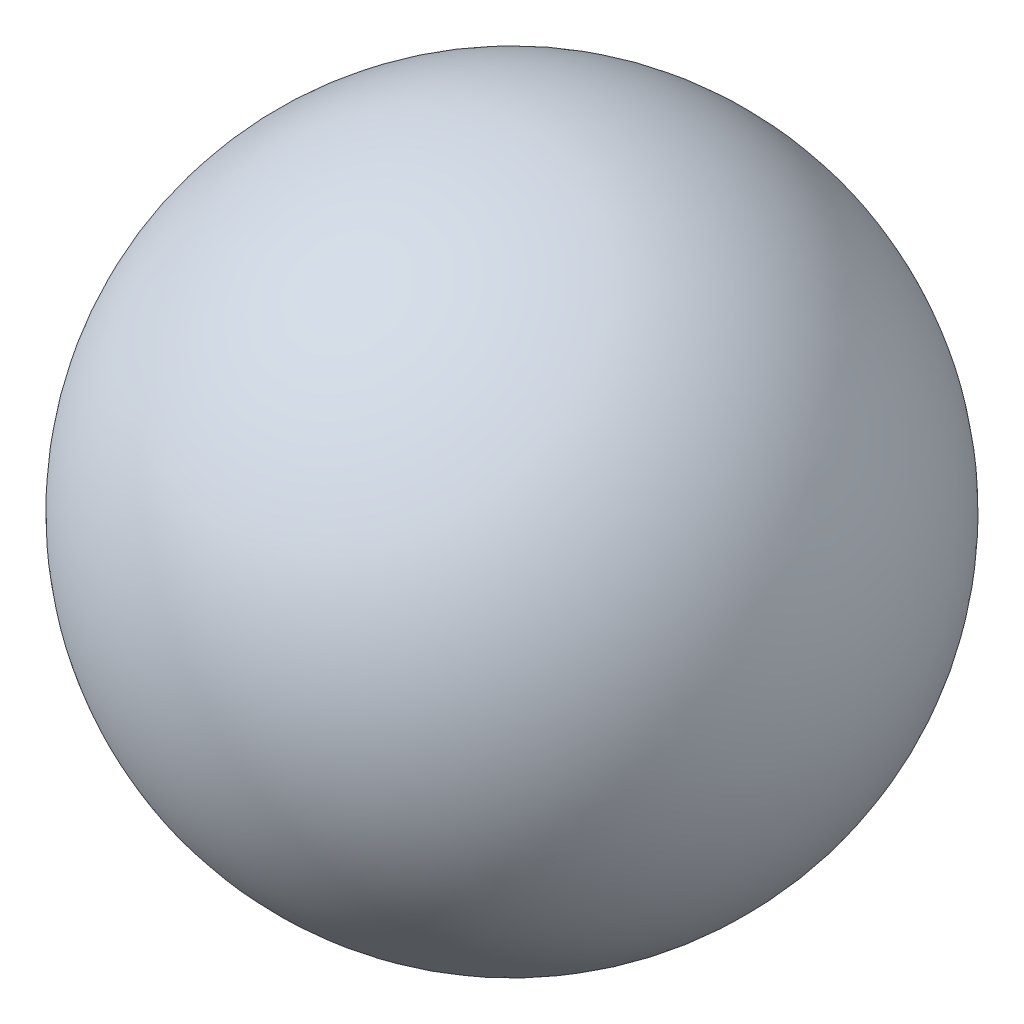
from build123d import *


with BuildPart() as part:
    # 草圖1 → 旋轉1 (revolve)
    with BuildSketch(Plane(origin=(0, 0, 0), x_dir=(1, 0, 0), z_dir=(0, 1, 0))):
        with BuildLine():
            Line((0, -44.869978607), (0, 44.869978607))
            ThreePointArc((0, 44.869978607), (-44.869978607, 0), (0, -44.869978607))
        make_face()
    revolve(axis=Axis((0, 0, -44.869978607), (0, 0, 1)))


solid = part.part
